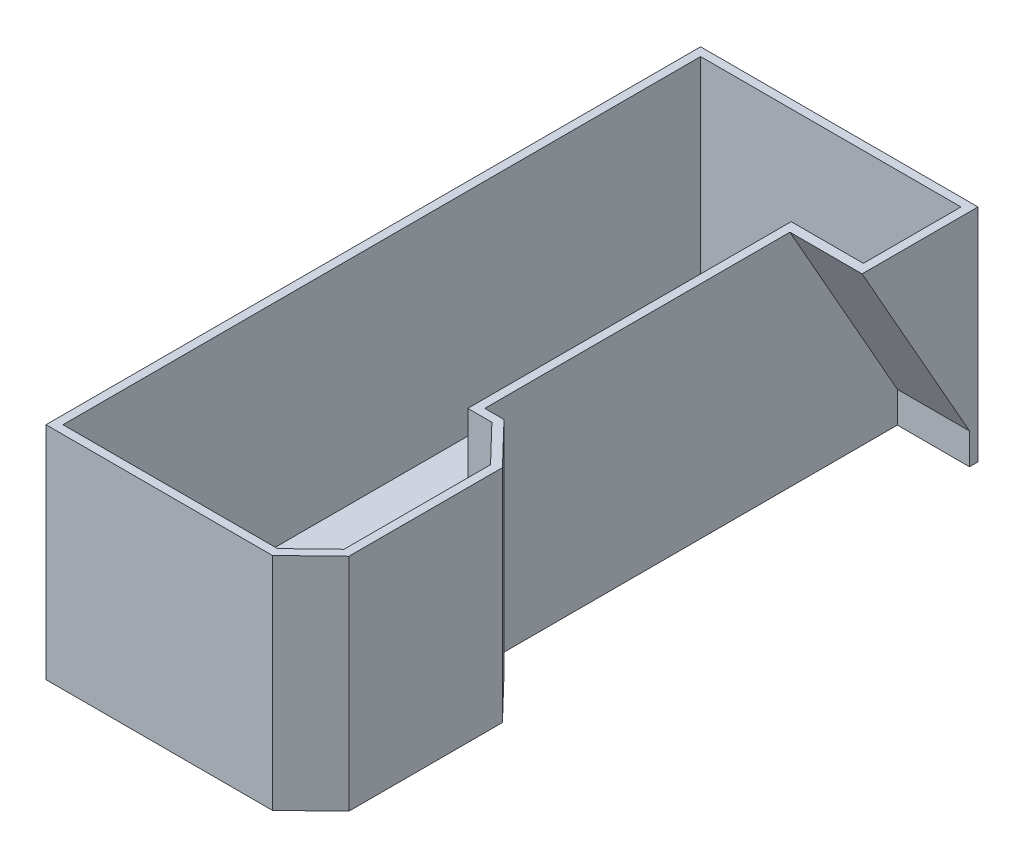
from build123d import *

# Parameters (mm, degrees)
SKETCH_1_W          = 290
SKETCH_1_H          = 925
EXTRUDE_1_DEPTH     = 12
EXTRUDE_3_DEPTH     = 12
EXTRUDE_4_DEPTH     = 300
CUT_EXTRUDE_1_DEPTH = 12
EXTRUDE_5_DEPTH     = 90
EXTRUDE_6_DEPTH     = 102
EXTRUDE_7_DEPTH     = 12
EXTRUDE_8_DEPTH     = 102


with BuildPart() as part:
    # 草图1 → 凸台-拉伸1 (new body)
    with BuildSketch(Plane(origin=(0, 0, 0), x_dir=(1, 0, 0), z_dir=(0, 1, 0))):
        with Locations((145, 462.5)):
            Rectangle(SKETCH_1_W, SKETCH_1_H)
    extrude(amount=EXTRUDE_1_DEPTH)

    # 草图3 → 凸台-拉伸3 (add)
    with BuildSketch(Plane(origin=(0, 12, 0), x_dir=(1, 0, 0), z_dir=(0, 1, 0))):
        Polygon((290, 330), (317.181818182, 330), (375, 270), (375, 53), (320, 0), (290, 0), align=None)
    extrude(amount=-EXTRUDE_3_DEPTH)

    # 草图4 → 凸台-拉伸4 (add)
    with BuildSketch(Plane(origin=(0, 12, 0), x_dir=(1, 0, 0), z_dir=(0, 1, 0))):
        Polygon((0, 925), (0, 0), (320, 0), (375, 53), (375, 270), (317.181818182, 330), (290, 330), (290, 925), align=None)
        Polygon((12, 913), (12, 12), (315.159103589, 12), (363, 58.101227451), (363, 265.159103589), (312.080590731, 318), (278, 318), (278, 913), align=None, mode=Mode.SUBTRACT)
    extrude(amount=EXTRUDE_4_DEPTH)

    # 草图5 → 切除-拉伸1 (cut)
    with BuildSketch(Plane(origin=(290, 0, 0), x_dir=(0, 0, -1), z_dir=(1, 0, 0))):
        Polygon((775, 312), (925, 47), (925, 312), align=None)
    extrude(amount=-CUT_EXTRUDE_1_DEPTH, mode=Mode.SUBTRACT)

    # 草图7 → 凸台-拉伸5 (add)
    with BuildSketch(Plane(origin=(290, 0, 0), x_dir=(0, 0, -1), z_dir=(1, 0, 0))):
        Polygon((775, 312), (925, 47), (925, 22.639376034), (761.210967567, 312), align=None)
    extrude(amount=EXTRUDE_5_DEPTH)

    # 草图8 → 凸台-拉伸6 (add)
    with BuildSketch(Plane(origin=(278, 0, 0), x_dir=(0, 0, -1), z_dir=(1, 0, 0))):
        Polygon((925, 312), (925, 47), (913, 68.2), (913, 312), align=None)
    extrude(amount=EXTRUDE_6_DEPTH)

    # 草图9 → 凸台-拉伸7 (add)
    with BuildSketch(Plane(origin=(380, 0, 0), x_dir=(0, 0, -1), z_dir=(1, 0, 0))):
        Polygon((761.210967567, 312), (925, 312), (925, 22.639376034), align=None)
    extrude(amount=EXTRUDE_7_DEPTH)

    # 草图10 → 凸台-拉伸8 (add)
    with BuildSketch(Plane(origin=(290, 0, 0), x_dir=(0, 0, -1), z_dir=(1, 0, 0))):
        Polygon((925, 0), (925, 22.639376034), (913, 43.839376034), (913, 0), align=None)
    extrude(amount=EXTRUDE_8_DEPTH)


solid = part.part
